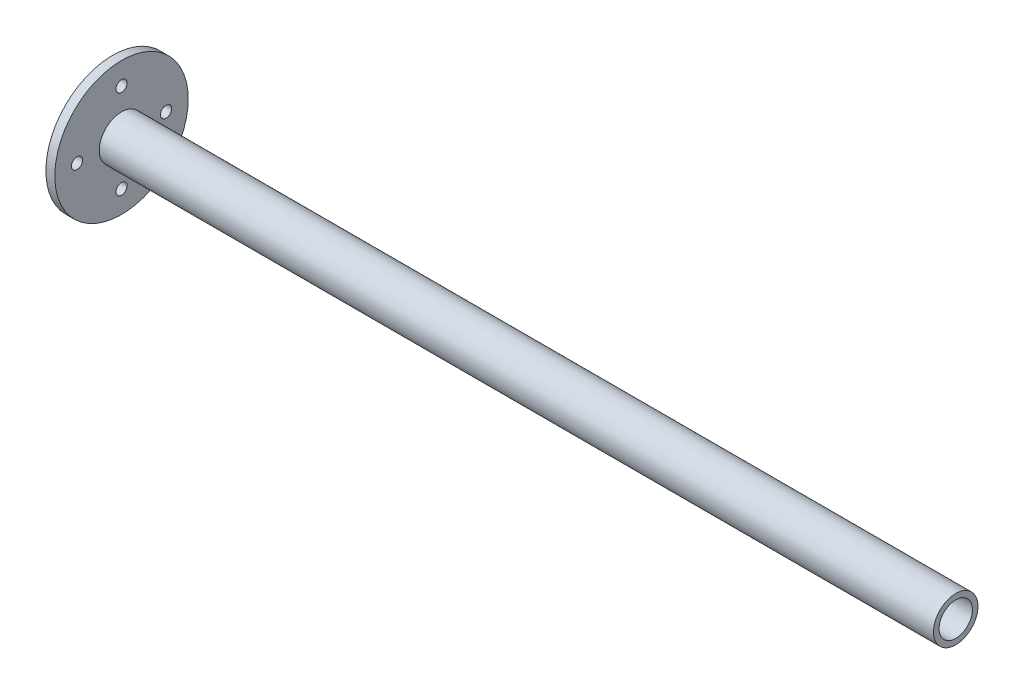
from build123d import *
from build123d.topology import SkipClean

# Parameters (mm, degrees)
SKETCH1_R           = 12
SKETCH1_R_2         = 1
SKETCH1_R_3         = 4
SKETCH1_R_4         = 3
BOSS_EXTRUDE1_DEPTH = 1.6
SKETCH2_R           = 4
SKETCH2_R_2         = 3
BOSS_EXTRUDE2_DEPTH = 150
SKETCH3_R           = 3
CUT_EXTRUDE1_DEPTH  = 150


with BuildPart() as part:
    # Sketch1 → Boss-Extrude1 (new body)
    # profile 1 of 3: a face of its own
    with BuildSketch(Plane(origin=(0, 0, 0), x_dir=(0, 0, -1), z_dir=(1, 0, 0))):
        Circle(SKETCH1_R)
        with Locations((-8, 0)):
            Circle(SKETCH1_R_2, mode=Mode.SUBTRACT)
        with Locations((0, -8)):
            Circle(SKETCH1_R_2, mode=Mode.SUBTRACT)
        with Locations((8, 0)):
            Circle(SKETCH1_R_2, mode=Mode.SUBTRACT)
        with Locations((0, 8)):
            Circle(SKETCH1_R_2, mode=Mode.SUBTRACT)
        Circle(SKETCH1_R_3, mode=Mode.SUBTRACT)
    # profile 2 of 3: a face of its own
    with BuildSketch(Plane(origin=(0, 0, 0), x_dir=(0, 0, -1), z_dir=(1, 0, 0))):
        Circle(SKETCH1_R_3)
        Circle(SKETCH1_R_4, mode=Mode.SUBTRACT)
    # profile 3 of 3: a face of its own
    with BuildSketch(Plane(origin=(0, 0, 0), x_dir=(0, 0, -1), z_dir=(1, 0, 0))):
        Circle(SKETCH1_R_4)
    extrude(amount=BOSS_EXTRUDE1_DEPTH)

    # Sketch2 → Boss-Extrude2 (add)
    with BuildSketch(Plane(origin=(1.6, 0, 0), x_dir=(0, 0, -1), z_dir=(1, 0, 0))):
        Circle(SKETCH2_R)
        Circle(SKETCH2_R_2, mode=Mode.SUBTRACT)
    extrude(amount=BOSS_EXTRUDE2_DEPTH)

    # Sketch3 → Cut-Extrude1 (cut)
    with SkipClean():  # the faces are left unmerged after this step: merging them gives an invalid solid
        with BuildSketch(Plane.ZY):
            Circle(SKETCH3_R)
        extrude(amount=-CUT_EXTRUDE1_DEPTH, mode=Mode.SUBTRACT)


solid = part.part
